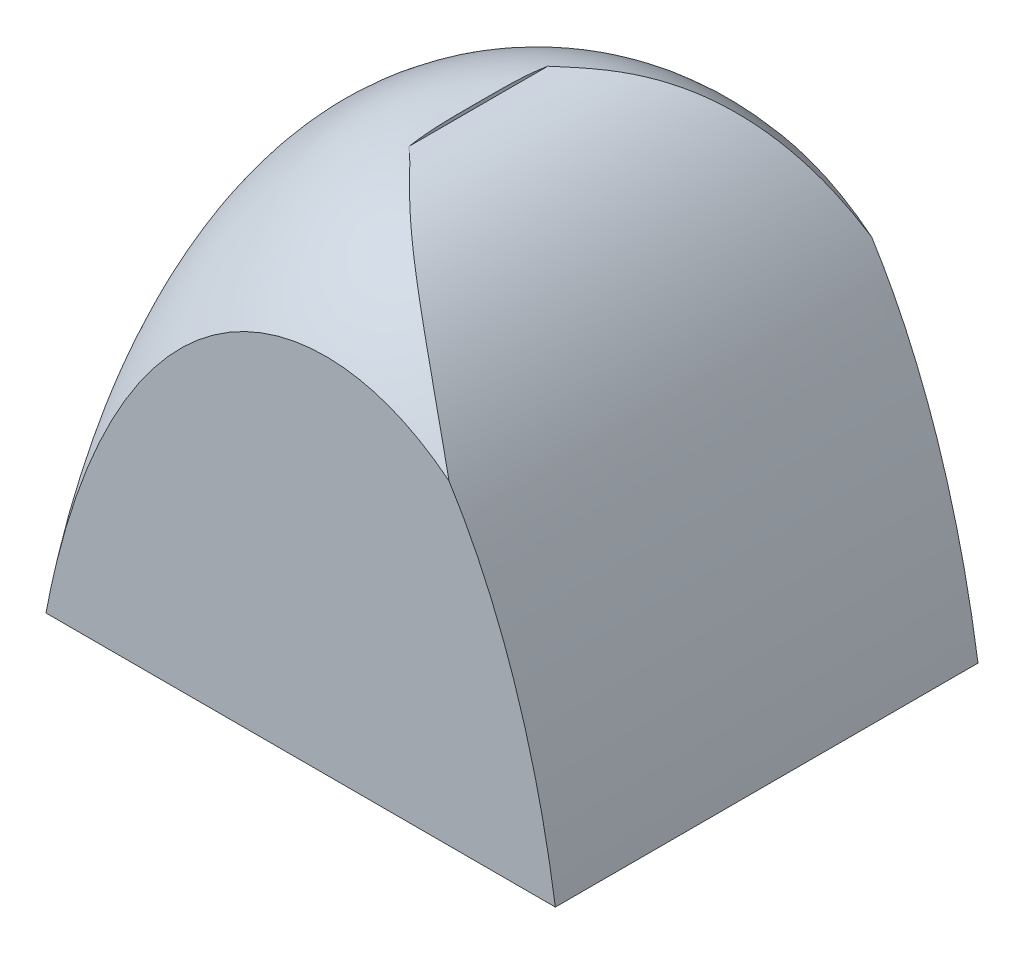
from build123d import *

# Parameters (mm, degrees)
BOSS_EXTRUDE1_DEPTH      = 237.5
BOSS_EXTRUDE1_DEPTH_BACK = 237.5
SKETCH1_RX               = 712.26718515
SKETCH1_RY               = 343.28059296
SKETCH7_W                = 1048.477934303
SKETCH7_H                = 944.198935412
CUT_EXTRUDE2_DEPTH       = 923.383384794
CUT_EXTRUDE3_DEPTH       = 475


with BuildPart() as part:
    # Sketch1 → Boss-Extrude1 (new, two sides: drawn at the far end of the back side and taken through both)
    with BuildSketch(Plane.XY.offset(-BOSS_EXTRUDE1_DEPTH_BACK)):
        with Locations(Location((0, 0), (0, 0, 90))):
            Ellipse(SKETCH1_RX, SKETCH1_RY)
    extrude(amount=BOSS_EXTRUDE1_DEPTH + BOSS_EXTRUDE1_DEPTH_BACK)

    # Sketch7 → Cut-Extrude2 (cut, through all)
    with BuildSketch(Plane.XY.offset(237.5)):
        with Locations((-29.38771787, -262.502282556)):
            Rectangle(SKETCH7_W, SKETCH7_H)
    extrude(amount=-CUT_EXTRUDE2_DEPTH, mode=Mode.SUBTRACT)

    # Sketch8 → Cut-Extrude3 (cut)
    with BuildSketch(Plane.XY.offset(237.5)):
        with BuildLine():
            Line((0, 708.26718515), (0, 868.490445355))
            Line((0, 868.490445355), (516.590298343, 876.65327174))
            Line((516.590298343, 876.65327174), (527.139965692, 209.010038101))
            Line((527.139965692, 209.010038101), (324.124503839, 209.010038101))
            add(Edge.make_bspline(
                [(324.124503839, 209.010038101), (318.786252307, 244.983503026), (312.067493742, 280.068143251), (296.042351498, 347.569026748), (286.736088994, 379.984546541), (265.778040641, 441.321345393), (254.126391738, 470.241929736), (235.119801323, 510.448466005), (228.529910203, 523.322336391), (214.885425564, 547.931236813), (207.830837938, 559.666242255), (193.30460489, 581.922629058), (185.832968753, 592.443982217), (170.523681837, 612.206551522), (162.686048398, 621.447734866), (146.698830534, 638.592635258), (138.549279355, 646.496317042), (121.994585001, 660.919103807), (113.58949986, 667.438181394), (96.581054475, 679.055860165), (87.977776806, 684.154465031), (70.629091286, 692.906968352), (61.883762042, 696.560929411), (35.513187174, 705.335566591), (17.755492201, 708.26718515), (0, 708.26718515)],
                knots=[0, 0, 0, 0, 0.0625, 0.0625, 0.125, 0.125, 0.1875, 0.1875, 0.21875, 0.21875, 0.25, 0.25, 0.28125, 0.28125, 0.3125, 0.3125, 0.34375, 0.34375, 0.375, 0.375, 0.40625, 0.40625, 0.4375, 0.4375, 0.5, 0.5, 0.5, 0.5], degree=3))
        make_face()
    extrude(amount=-CUT_EXTRUDE3_DEPTH, mode=Mode.SUBTRACT)

    # Sketch11 → Cut-Revolve2 (revolve, cut)
    with BuildSketch(Plane.XY):
        with BuildLine():
            Line((-343.28059296, 0), (-743.226651757, 0))
            Line((-743.226651757, 0), (-743.226651757, 860.341056905))
            Line((-743.226651757, 860.341056905), (0, 860.341056905))
            Line((0, 860.341056905), (0, 712.26718515))
            add(Edge.make_bspline(
                [(0, 712.26718515), (-343.28059296, 712.26718515), (-343.28059296, 0)],
                knots=[0, 0, 0, 1.570796327, 1.570796327, 1.570796327], degree=2, weights=[1, 0.707106781, 1]))
        make_face()
    revolve(axis=Axis((65.79623911, 0, 0), (0, 1, 0)), mode=Mode.SUBTRACT)


solid = part.part
